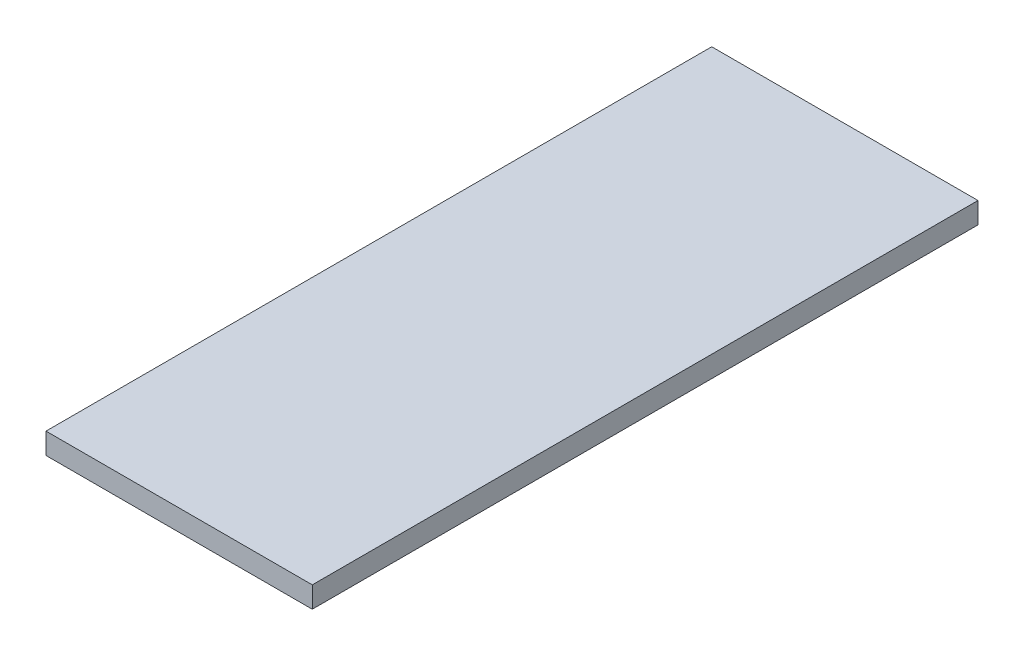
from build123d import *

# Parameters (mm, degrees)
CROQUIS1_W              = 320
CROQUIS1_H              = 800
SALIENTE_EXTRUIR1_DEPTH = 25.4


with BuildPart() as part:
    # Croquis1 → Saliente-Extruir1 (new body)
    with BuildSketch(Plane(origin=(0, 0, 0), x_dir=(1, 0, 0), z_dir=(0, 1, 0))):
        Rectangle(CROQUIS1_W, CROQUIS1_H)
    extrude(amount=SALIENTE_EXTRUIR1_DEPTH)


solid = part.part
